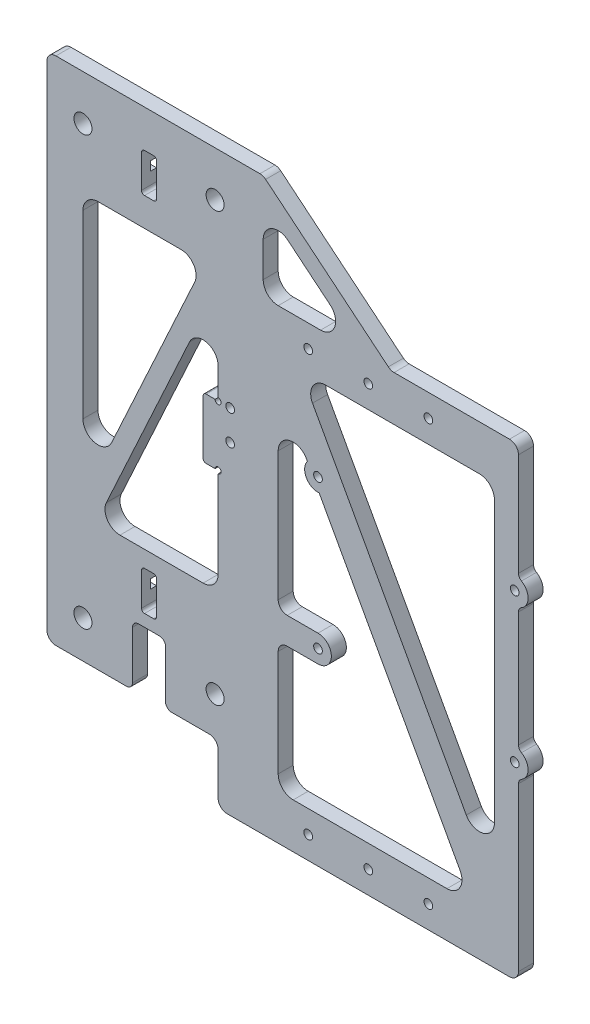
from build123d import *

# Parameters (mm, degrees)
SKETCH_1_R          = 3
SKETCH_1_R_2        = 1.45
SKETCH_1_W          = 72
SKETCH_1_H          = 125
SKETCH_1_W_2        = 45
SKETCH_1_H_2        = 92.5
EXTRUDE_1_DEPTH     = 5
SKETCH_2_W          = 5
SKETCH_2_H          = 13
CUT_EXTRUDE_1_DEPTH = 215.767315949
CUT_EXTRUDE_START   = -5
SKETCH_3_W          = 12
SKETCH_3_H          = 3
CUT_EXTRUDE_2_DEPTH = 2
EXTRUDE_2_DEPTH     = 5
FILLET_1_R          = 5
FILLET_2_R          = 3
SKETCH_5_R          = 1.45
CUT_EXTRUDE_3_DEPTH = 215.767315949
EXTRUDE_START       = 5
SKETCH_6_R          = 4.45
SKETCH_6_R_2        = 1.45
EXTRUDE_3_DEPTH     = 5
SKETCH_7_W          = 5
SKETCH_7_H          = 20
EXTRUDE_4_DEPTH     = 5
SKETCH_8_R          = 1.45
CUT_EXTRUDE_4_DEPTH = 217.275842387
FILLET_3_R          = 3
SKETCH_9_R          = 1
CUT_EXTRUDE_5_DEPTH = 217.275842387
FILLET_4_R          = 1
FILLET_5_R          = 1
SKETCH_10_W         = 11
SKETCH_10_H         = 20
CUT_EXTRUDE_6_DEPTH = 10
FILLET_6_R          = 2


with BuildPart() as part:
    # 草图1 → 凸台-拉伸1 (new body)
    with BuildSketch(Plane.XY):
        Polygon((-57, 190), (-57, 20), (0, 20), (0, 0), (100, 0), (100, 155), (15, 155), (15, 190), align=None)
        with Locations((-45, 175)):
            Circle(SKETCH_1_R, mode=Mode.SUBTRACT)
        with Locations((-1, 175)):
            Circle(SKETCH_1_R, mode=Mode.SUBTRACT)
        with Locations((-1, 32.5)):
            Circle(SKETCH_1_R, mode=Mode.SUBTRACT)
        with Locations((-45, 32.5)):
            Circle(SKETCH_1_R, mode=Mode.SUBTRACT)
        with Locations((30, 7.5)):
            Circle(SKETCH_1_R_2, mode=Mode.SUBTRACT)
        with Locations((50, 7.5)):
            Circle(SKETCH_1_R_2, mode=Mode.SUBTRACT)
        with Locations((30, 147.5)):
            Circle(SKETCH_1_R_2, mode=Mode.SUBTRACT)
        with Locations((50, 147.5)):
            Circle(SKETCH_1_R_2, mode=Mode.SUBTRACT)
        with Locations((70, 147.5)):
            Circle(SKETCH_1_R_2, mode=Mode.SUBTRACT)
        with Locations((70, 7.5)):
            Circle(SKETCH_1_R_2, mode=Mode.SUBTRACT)
        with Locations((56, 77.5)):
            Rectangle(SKETCH_1_W, SKETCH_1_H, mode=Mode.SUBTRACT)
        with Locations((-22.5, 108.75)):
            Rectangle(SKETCH_1_W_2, SKETCH_1_H_2, mode=Mode.SUBTRACT)
    extrude(amount=EXTRUDE_1_DEPTH)

    # 草图2 → 切除-拉伸1 (cut, through all)
    with BuildSketch(Plane.XY.offset(5)):
        with Locations((-23, 171)):
            Rectangle(SKETCH_2_W, SKETCH_2_H)
        with Locations((-23, 50.5)):
            Rectangle(SKETCH_2_W, SKETCH_2_H)
    extrude(amount=-CUT_EXTRUDE_1_DEPTH, mode=Mode.SUBTRACT)

    # 草图3 → 切除-拉伸2 (cut)
    with BuildSketch(Plane.XY.offset(5).offset(CUT_EXTRUDE_START)):
        with Locations((-23, 50.5)):
            Rectangle(SKETCH_3_W, SKETCH_3_H)
        with Locations((-23, 171)):
            Rectangle(SKETCH_3_W, SKETCH_3_H)
    extrude(amount=CUT_EXTRUDE_2_DEPTH, mode=Mode.SUBTRACT)

    # 草图4 → 凸台-拉伸2 (add)
    with BuildSketch(Plane.XY):
        Polygon((-4.523420353, 155), (-45, 67.023420353), (-45, 62.5), (-40.476579647, 62.5), (0, 150.476579647), (0, 155), align=None)
        Polygon((20, 140), (20, 132.636069246), (84.636069246, 15), (92, 15), (92, 22.363930754), (27.363930754, 140), align=None)
        Polygon((15, 190), (57.5, 155), (48.061693338, 155), (15, 182.227276866), align=None)
    extrude(amount=EXTRUDE_2_DEPTH)

    # 圆角1
    fillet_1_edges = [part.edges().sort_by_distance(p)[0] for p in [
        (15, 155, 2.5),
        (-4.523420353, 155, 2.5),
        (-45, 67.023420353, 2.5),
        (-40.476579647, 62.5, 2.5),
        (0, 150.476579647, 2.5),
        (27.363930754, 140, 2.5),
        (20, 132.636069246, 2.5),
        (84.636069246, 15, 2.5),
        (92, 22.363930754, 2.5),
        (15, 182.227276866, 2.5),
        (48.061693338, 155, 2.5),
        (20, 15, 2.5),
        (92, 140, 2.5),
        (-45, 155, 2.5),
        (0, 62.5, 2.5),
    ]]
    fillet(fillet_1_edges, radius=FILLET_1_R)

    # 圆角2
    fillet_2_edges = [part.edges().sort_by_distance(p)[0] for p in [
        (15, 190, 2.5),
        (100, 155, 2.5),
        (100, 0, 2.5),
        (0, 0, 2.5),
        (0, 20, 2.5),
        (-57, 20, 2.5),
        (-57, 190, 2.5),
        (57.5, 155, 2.5),
    ]]
    fillet(fillet_2_edges, radius=FILLET_2_R)

    # 草图5 → 切除-拉伸3 (cut, through all)
    with BuildSketch(Plane.XY.offset(5)):
        with Locations((98.75, 112.25)):
            Circle(SKETCH_5_R)
        with Locations((98.75, 62.75)):
            Circle(SKETCH_5_R)
        with Locations((33.25, 112.25)):
            Circle(SKETCH_5_R)
        with Locations((33.25, 62.75)):
            Circle(SKETCH_5_R)
    extrude(amount=-CUT_EXTRUDE_3_DEPTH, mode=Mode.SUBTRACT)

    # 草图6 → 凸台-拉伸3 (add)
    # profile 1 of 4: a face of its own
    with BuildSketch(Plane.XY.offset(EXTRUDE_START)):
        with Locations((33.25, 112.25)):
            Circle(SKETCH_6_R)
        with Locations((33.25, 112.25)):
            Circle(SKETCH_6_R_2, mode=Mode.SUBTRACT)
    # profile 2 of 4: a face of its own
    with BuildSketch(Plane.XY.offset(EXTRUDE_START)):
        with Locations((98.75, 62.75)):
            Circle(SKETCH_6_R)
        with Locations((98.75, 62.75)):
            Circle(SKETCH_6_R_2, mode=Mode.SUBTRACT)
    # profile 3 of 4: a face of its own
    with BuildSketch(Plane.XY.offset(EXTRUDE_START)):
        with Locations((98.75, 112.25)):
            Circle(SKETCH_6_R)
        with Locations((98.75, 112.25)):
            Circle(SKETCH_6_R_2, mode=Mode.SUBTRACT)
    # profile 4 of 4: a face of its own
    with BuildSketch(Plane.XY.offset(EXTRUDE_START)):
        with BuildLine():
            Line((33.25, 67.2), (20, 67.2))
            Line((20, 67.2), (20, 58.3))
            Line((20, 58.3), (33.25, 58.3))
            ThreePointArc((33.25, 58.3), (37.7, 62.75), (33.25, 67.2))
        make_face()
        with Locations((33.25, 62.75)):
            Circle(SKETCH_6_R_2, mode=Mode.SUBTRACT)
    extrude(amount=-EXTRUDE_3_DEPTH)

    # 草图7 → 凸台-拉伸4 (add)
    with BuildSketch(Plane.XY):
        with Locations((-2.5, 107.5)):
            Rectangle(SKETCH_7_W, SKETCH_7_H)
    extrude(amount=EXTRUDE_4_DEPTH)

    # 草图8 → 切除-拉伸4 (cut, through all)
    with BuildSketch(Plane.XY.offset(5)):
        with Locations((4, 117.5)):
            Circle(SKETCH_8_R)
        with Locations((4, 107.5)):
            Circle(SKETCH_8_R)
    extrude(amount=-CUT_EXTRUDE_4_DEPTH, mode=Mode.SUBTRACT)

    # 圆角3
    fillet_3_edges = [part.edges().sort_by_distance(p)[0] for p in [
        (20, 58.3, 2.5),
        (20, 67.2, 2.5),
    ]]
    fillet(fillet_3_edges, radius=FILLET_3_R)

    # 草图9 → 切除-拉伸5 (cut, through all)
    with BuildSketch(Plane.XY.offset(5)):
        with Locations((0, 117.5)):
            Circle(SKETCH_9_R)
        with Locations((0, 97.5)):
            Circle(SKETCH_9_R)
    extrude(amount=-CUT_EXTRUDE_5_DEPTH, mode=Mode.SUBTRACT)

    # 圆角4
    fillet_4_edges = [part.edges().sort_by_distance(p)[0] for p in [
        (-5, 117.5, 2.5),
        (-5, 97.5, 2.5),
    ]]
    fillet(fillet_4_edges, radius=FILLET_4_R)

    # 圆角5
    fillet_5_edges = [part.edges().sort_by_distance(p)[0] for p in [
        (-25.5, 177.5, 2.5),
        (-20.5, 177.5, 2.5),
        (-20.5, 164.5, 2.5),
        (-25.5, 164.5, 2.5),
        (-20.5, 44, 2.5),
        (-25.5, 44, 2.5),
        (-25.5, 57, 2.5),
        (-20.5, 57, 2.5),
        (-29, 49, 1),
        (-17, 49, 1),
        (-17, 52, 1),
        (-29, 52, 1),
        (-17, 172.5, 1),
        (-29, 169.5, 1),
        (-17, 169.5, 1),
        (-29, 172.5, 1),
    ]]
    fillet(fillet_5_edges, radius=FILLET_5_R)

    # 草图10 → 切除-拉伸6 (cut)
    with BuildSketch(Plane.XY.offset(5)):
        with Locations((-23, 30)):
            Rectangle(SKETCH_10_W, SKETCH_10_H)
    extrude(amount=-CUT_EXTRUDE_6_DEPTH, mode=Mode.SUBTRACT)

    # 圆角6
    fillet_6_edges = [part.edges().sort_by_distance(p)[0] for p in [
        (100, 116.520831301, 2.5),
        (100, 107.979168699, 2.5),
        (100, 58.479168699, 2.5),
        (100, 67.020831301, 2.5),
        (-17.5, 20, 2.5),
        (-28.5, 20, 2.5),
        (-28.5, 40, 2.5),
        (-17.5, 40, 2.5),
    ]]
    fillet(fillet_6_edges, radius=FILLET_6_R)


solid = part.part
